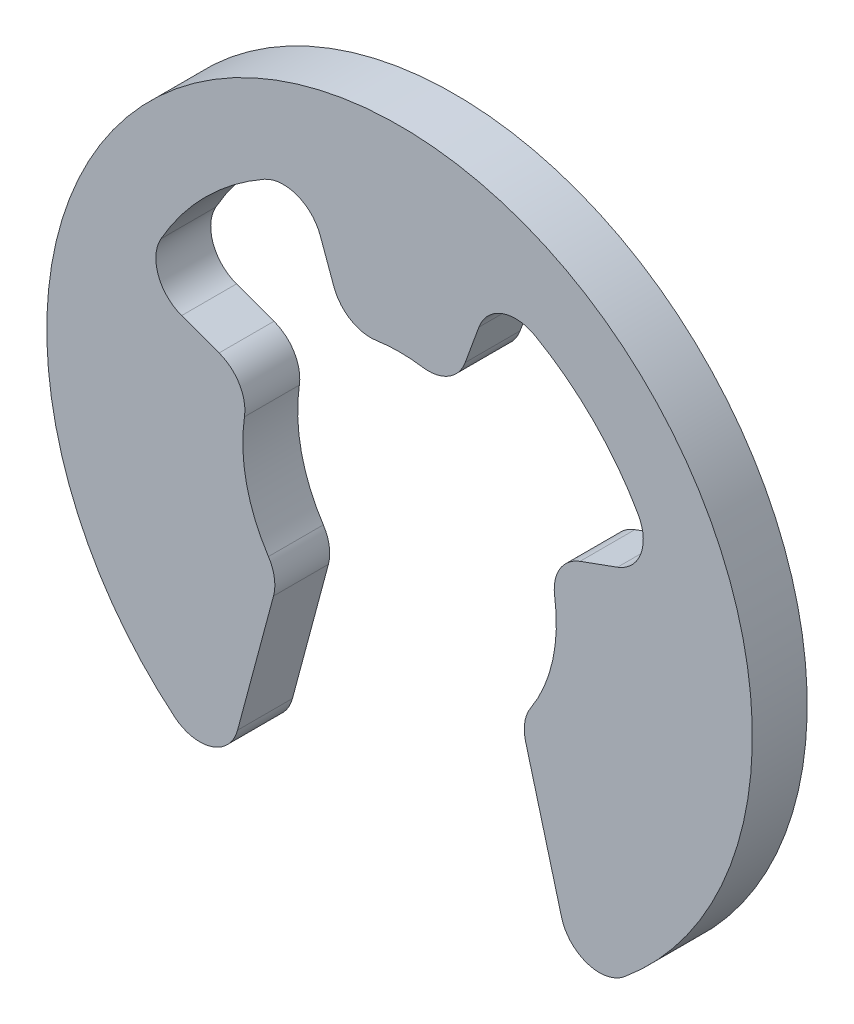
from build123d import *

# Parameters (mm, degrees)
BASE_EXTRUSION_DEPTH = 0.7


with BuildPart() as part:
    # Esquisse1 → Base-Extrusion (new body)
    with BuildSketch(Plane.XY):
        with BuildLine():
            Line((-1.607738908, -1.500163291), (-2.066362316, -3.21176915))
            ThreePointArc((-2.066362316, -3.21176915), (-2.397280052, -3.558681225), (-2.867990883, -3.467654581))
            ThreePointArc((-2.867990883, -3.467654581), (0, 4.5), (2.867990883, -3.467654581))
            ThreePointArc((2.867990883, -3.467654581), (2.397280052, -3.558681225), (2.066362316, -3.21176915))
            Line((2.066362316, -3.21176915), (1.607738908, -1.500163291))
            ThreePointArc((1.607738908, -1.500163291), (1.597029862, -1.291456879), (1.672561457, -1.096603015))
            ThreePointArc((1.672561457, -1.096603015), (1.953391295, -0.429258021), (1.978222006, 0.294342818))
            ThreePointArc((1.978222006, 0.294342818), (2.043156778, 0.623713644), (2.301767436, 0.837774833))
            Line((2.301767436, 0.837774833), (2.779648258, 1.011709228))
            ThreePointArc((2.779648258, 1.011709228), (3.07787576, 1.308882148), (3.043411217, 1.728481461))
            ThreePointArc((3.043411217, 1.728481461), (2.474873734, 2.474873734), (1.728481461, 3.043411217))
            ThreePointArc((1.728481461, 3.043411217), (1.308882148, 3.07787576), (1.011709228, 2.779648258))
            Line((1.011709228, 2.779648258), (0.837774833, 2.301767436))
            ThreePointArc((0.837774833, 2.301767436), (0.623713644, 2.043156778), (0.294342818, 1.978222006))
            ThreePointArc((0.294342818, 1.978222006), (0, 2), (-0.294342818, 1.978222006))
            ThreePointArc((-0.294342818, 1.978222006), (-0.623713644, 2.043156778), (-0.837774833, 2.301767436))
            Line((-0.837774833, 2.301767436), (-1.011709228, 2.779648258))
            ThreePointArc((-1.011709228, 2.779648258), (-1.308882148, 3.07787576), (-1.728481461, 3.043411217))
            ThreePointArc((-1.728481461, 3.043411217), (-2.474873734, 2.474873734), (-3.043411217, 1.728481461))
            ThreePointArc((-3.043411217, 1.728481461), (-3.07787576, 1.308882148), (-2.779648258, 1.011709228))
            Line((-2.779648258, 1.011709228), (-2.301767436, 0.837774833))
            ThreePointArc((-2.301767436, 0.837774833), (-2.043156778, 0.623713644), (-1.978222006, 0.294342818))
            ThreePointArc((-1.978222006, 0.294342818), (-1.953391295, -0.429258021), (-1.672561457, -1.096603015))
            ThreePointArc((-1.672561457, -1.096603015), (-1.597029862, -1.291456879), (-1.607738908, -1.500163291))
        make_face()
    extrude(amount=BASE_EXTRUSION_DEPTH)


solid = part.part
